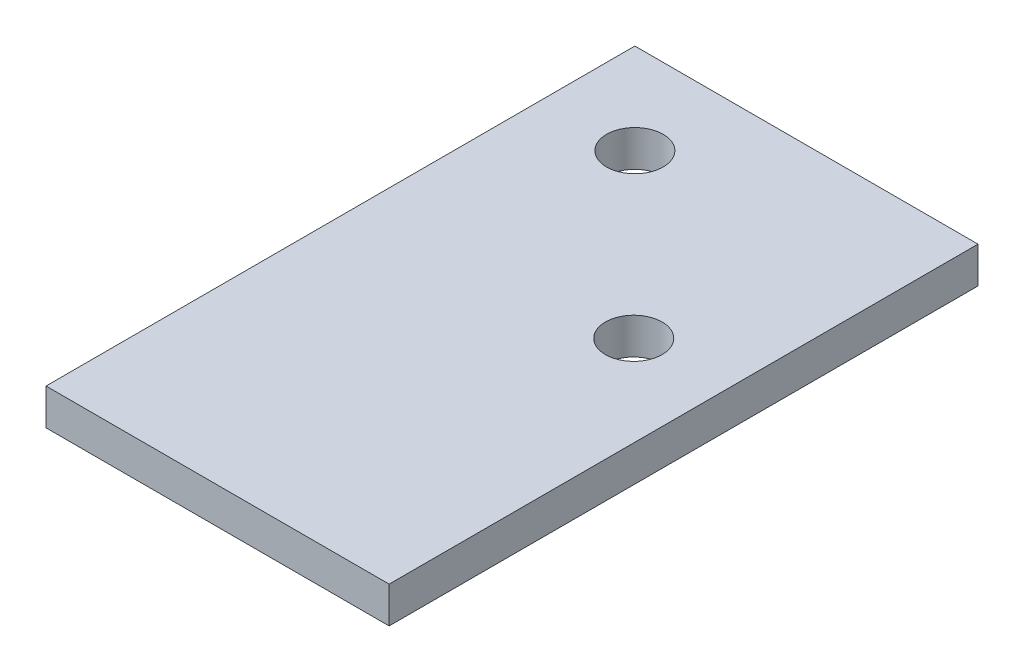
from build123d import *

# Parameters (mm, degrees)
SKETCH1_W           = 30.3
SKETCH1_H           = 52
BOSS_EXTRUDE1_DEPTH = 3.2
M6_TAPPED_HOLE1_D   = 5


with BuildPart() as part:
    # Sketch1 → Boss-Extrude1 (new body)
    with BuildSketch(Plane(origin=(0, 0, 0), x_dir=(1, 0, 0), z_dir=(0, 1, 0))):
        Rectangle(SKETCH1_W, SKETCH1_H)
    extrude(amount=-BOSS_EXTRUDE1_DEPTH)

    # M6 Tapped Hole1 (through all)
    with Locations(Plane(origin=(0, 0, 0), x_dir=(1, 0, 0), z_dir=(0, 1, 0))):
        with Locations((-7.15, 18), (7.15, 3.6)):
            Hole(M6_TAPPED_HOLE1_D / 2)


solid = part.part
